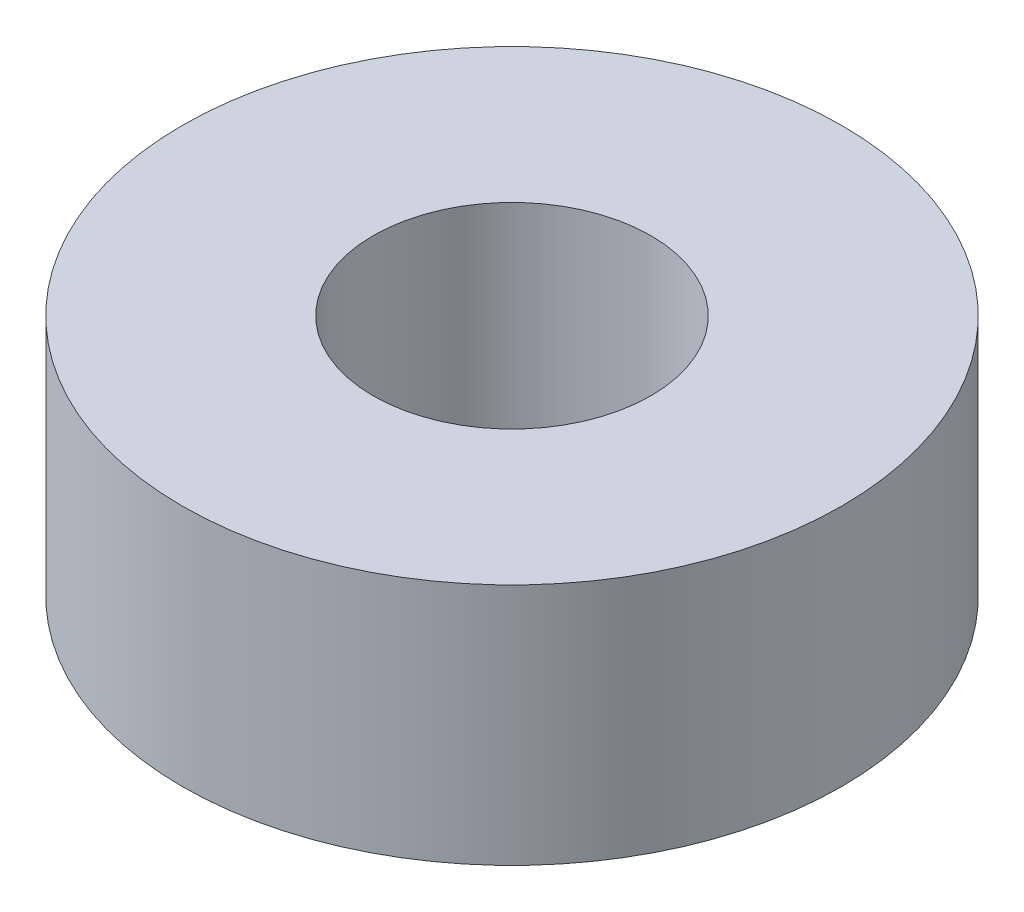
from build123d import *

# Parameters (mm, degrees)
SKETCH_1_R      = 9.5
SKETCH_1_R_2    = 4
EXTRUDE_1_DEPTH = 7


with BuildPart() as part:
    # 草图1 → 凸台-拉伸1 (new body)
    with BuildSketch(Plane(origin=(0, 0, 0), x_dir=(1, 0, 0), z_dir=(0, 1, 0))):
        with Locations(Location((0, 0, 0), (0, 0, 270))):
            Circle(SKETCH_1_R)
        with Locations(Location((0, 0, 0), (0, 0, 270))):
            Circle(SKETCH_1_R_2, mode=Mode.SUBTRACT)
    extrude(amount=EXTRUDE_1_DEPTH)


solid = part.part
